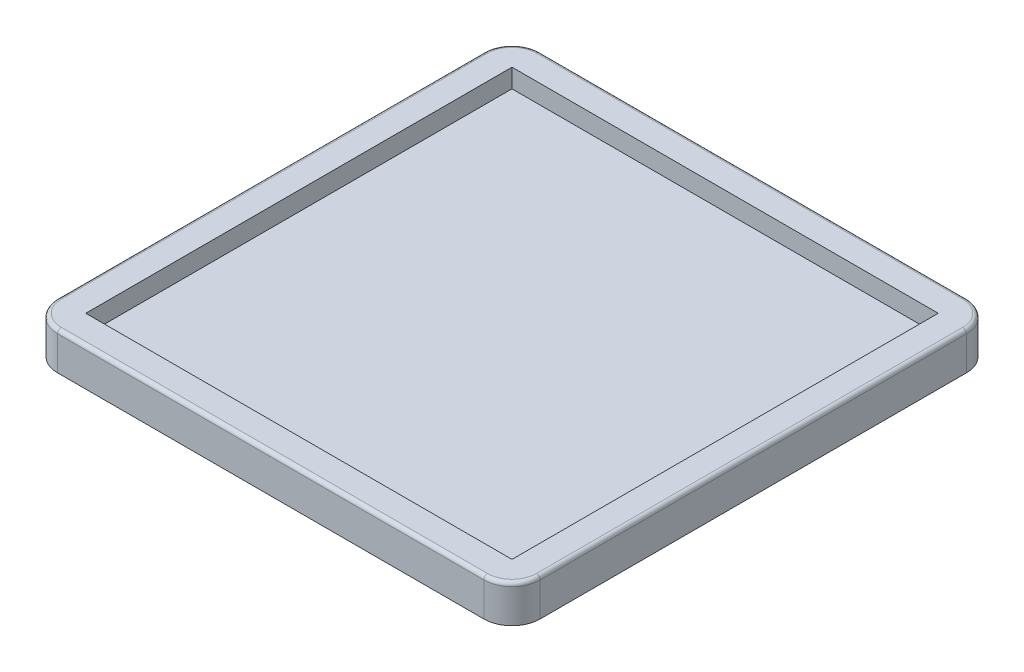
from build123d import *

# Parameters (mm, degrees)
SKETCH1_W           = 128.5
SKETCH1_H           = 128.5
BOSS_EXTRUDE1_DEPTH = 10
SKETCH2_W           = 113.5
SKETCH2_H           = 113.5
CUT_EXTRUDE3_DEPTH  = 5
FILLET1_R           = 7.5
FILLET2_R           = 1


with BuildPart() as part:
    # Sketch1 → Boss-Extrude1 (new body)
    with BuildSketch(Plane(origin=(0, 0, 0), x_dir=(1, 0, 0), z_dir=(0, 1, 0))):
        Rectangle(SKETCH1_W, SKETCH1_H)
    extrude(amount=BOSS_EXTRUDE1_DEPTH)

    # Sketch2 → Cut-Extrude3 (cut)
    with BuildSketch(Plane(origin=(0, 10, 0), x_dir=(1, 0, 0), z_dir=(0, 1, 0))):
        Rectangle(SKETCH2_W, SKETCH2_H)
    extrude(amount=-CUT_EXTRUDE3_DEPTH, mode=Mode.SUBTRACT)

    # Fillet1
    fillet1_edges = [part.edges().sort_by_distance(p)[0] for p in [
        (64.25, 5, 64.25),
        (-64.25, 5, 64.25),
        (-64.25, 5, -64.25),
        (64.25, 5, -64.25),
    ]]
    fillet(fillet1_edges, radius=FILLET1_R)

    # Fillet2
    fillet2_edges = [part.edges().sort_by_distance(p)[0] for p in [
        (64.25, 10, 0),
        (0, 10, 64.25),
        (0, 10, -64.25),
        (-64.25, 10, 0),
        (-62.053300859, 10, 62.053300859),
        (-62.053300859, 10, -62.053300859),
        (62.053300859, 10, -62.053300859),
        (62.053300859, 10, 62.053300859),
    ]]
    fillet(fillet2_edges, radius=FILLET2_R)


solid = part.part
